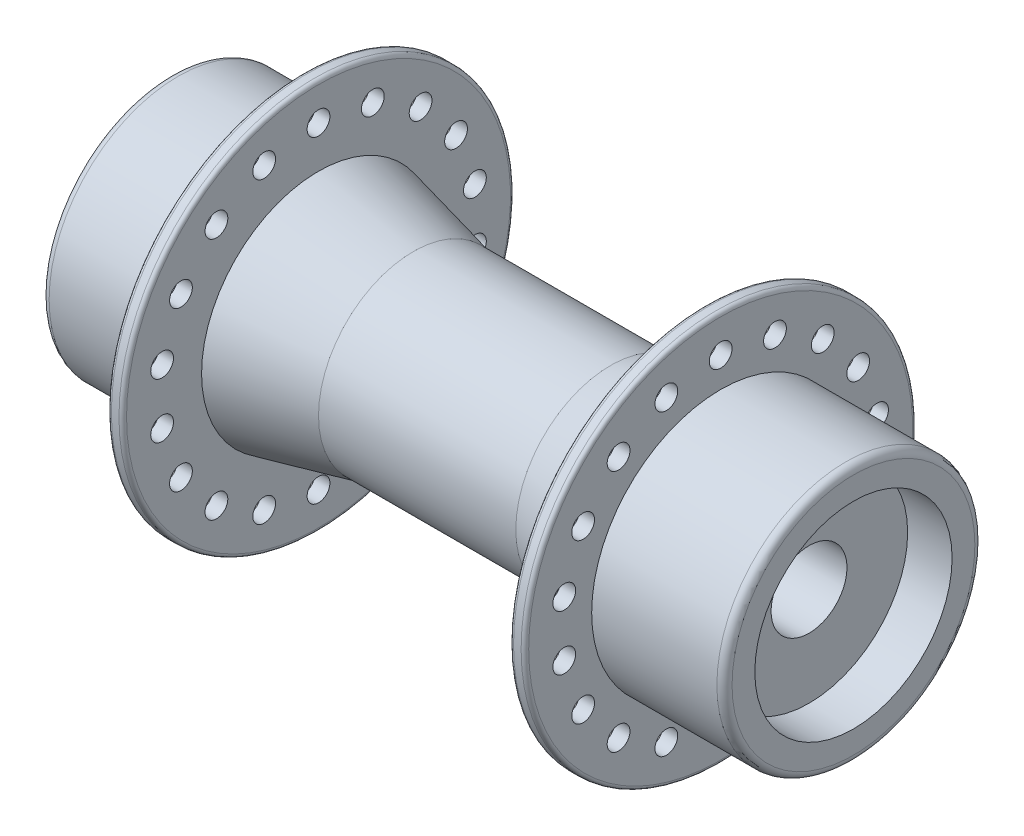
from build123d import *

# Parameters (mm, degrees)
CUT_EXTRUDE1_REACH       = 83.164
SKETCH2_R                = 1.5
CIRPATTERN1_COUNT        = 18
MIRROR1_COPY_1_REACH     = 83.164
MIRROR1_COPY_1_SKETCH_R  = 1.5
MIRROR1_COPY_2_REACH     = 83.164
MIRROR1_COPY_2_SKETCH_R  = 1.5
MIRROR1_COPY_3_REACH     = 83.164
MIRROR1_COPY_3_SKETCH_R  = 1.5
MIRROR1_COPY_4_REACH     = 83.164
MIRROR1_COPY_4_SKETCH_R  = 1.5
MIRROR1_COPY_5_REACH     = 83.164
MIRROR1_COPY_5_SKETCH_R  = 1.5
MIRROR1_COPY_6_REACH     = 83.164
MIRROR1_COPY_6_SKETCH_R  = 1.5
MIRROR1_COPY_7_REACH     = 83.164
MIRROR1_COPY_7_SKETCH_R  = 1.5
MIRROR1_COPY_8_REACH     = 83.164
MIRROR1_COPY_8_SKETCH_R  = 1.5
MIRROR1_COPY_9_REACH     = 83.164
MIRROR1_COPY_9_SKETCH_R  = 1.5
MIRROR1_COPY_10_REACH    = 83.164
MIRROR1_COPY_10_SKETCH_R = 1.5
MIRROR1_COPY_11_REACH    = 83.164
MIRROR1_COPY_11_SKETCH_R = 1.5
MIRROR1_COPY_12_REACH    = 83.164
MIRROR1_COPY_12_SKETCH_R = 1.5
MIRROR1_COPY_13_REACH    = 83.164
MIRROR1_COPY_13_SKETCH_R = 1.5
MIRROR1_COPY_14_REACH    = 83.164
MIRROR1_COPY_14_SKETCH_R = 1.5
MIRROR1_COPY_15_REACH    = 83.164
MIRROR1_COPY_15_SKETCH_R = 1.5
MIRROR1_COPY_16_REACH    = 83.164
MIRROR1_COPY_16_SKETCH_R = 1.5
MIRROR1_COPY_17_REACH    = 83.164
MIRROR1_COPY_17_SKETCH_R = 1.5


with BuildPart() as part:
    # Sketch1 → Revolve1 (revolve)
    with BuildSketch(Plane.XY, mode=Mode.PRIVATE) as revolve1_sk:
        with BuildLine():
            Line((-44, 17), (-27.5, 17))
            Line((-27.5, 17), (-27.5, 25.3))
            ThreePointArc((-27.5, 25.3), (-27.353553391, 25.653553391), (-27, 25.8))
            Line((-27, 25.8), (-26, 25.8))
            ThreePointArc((-26, 25.8), (-25.646446609, 25.653553391), (-25.5, 25.3))
            Line((-25.5, 25.3), (-25.5, 15.41105918))
            Line((-25.5, 15.41105918), (-13, 12.5))
            Line((-13, 12.5), (13, 12.5))
            Line((13, 12.5), (25.5, 15.41105918))
            Line((25.5, 15.41105918), (25.5, 25.3))
            ThreePointArc((25.5, 25.3), (25.646446609, 25.653553391), (26, 25.8))
            Line((26, 25.8), (27, 25.8))
            ThreePointArc((27, 25.8), (27.353553391, 25.653553391), (27.5, 25.3))
            Line((27.5, 25.3), (27.5, 17))
            Line((27.5, 17), (44, 17))
            ThreePointArc((44, 17), (44.707106781, 16.707106781), (45, 16))
            Line((45, 16), (45, 13))
            Line((45, 13), (39.143298455, 13))
            Line((39.143298455, 13), (39.143298455, 12.5))
            Line((39.143298455, 12.5), (39.143298455, 5))
            Line((39.143298455, 5), (-39.143298455, 5))
            Line((-39.143298455, 5), (-39.143298455, 12.5))
            Line((-39.143298455, 12.5), (-39.143298455, 13))
            Line((-39.143298455, 13), (-45, 13))
            Line((-45, 13), (-45, 16))
            ThreePointArc((-45, 16), (-44.707106781, 16.707106781), (-44, 17))
        make_face()
    revolve(revolve1_sk.sketch.rotate(Axis((0, 0, 0), (1, 0, 0)), 90), axis=Axis((0, 0, 0), (1, 0, 0)))

    # Sketch2 → Cut-Extrude1 (cut, up to next)
    with BuildSketch(Plane(origin=(27.5, 0, 0), x_dir=(0, 0, -1), z_dir=(1, 0, 0)), mode=Mode.PRIVATE) as cut_extrude1_sk1:
        with Locations((0, 20.930422405)):
            Circle(SKETCH2_R)
    cut_extrude1_tool1 = extrude(cut_extrude1_sk1.sketch, amount=-CUT_EXTRUDE1_REACH, mode=Mode.PRIVATE) & part.part
    cut_extrude1 = cut_extrude1_tool1.solids().sort_by_distance((27.5, 20.930422, 0))[0]
    add(cut_extrude1, mode=Mode.SUBTRACT)

    # CirPattern1: Cut-Extrude1 ×18 about axis
    cirpattern1_axis = Axis((0, 0, 0), (1, 0, 0))
    for i in range(1, CIRPATTERN1_COUNT):
        add(cut_extrude1.rotate(cirpattern1_axis, i * 360 / CIRPATTERN1_COUNT), mode=Mode.SUBTRACT)

    # Mirror1: Cut-Extrude1 across plane
    add(cut_extrude1.mirror(Plane(origin=(0, 0, 0), x_dir=(0, 0, 1), z_dir=(1, 0, 0))), mode=Mode.SUBTRACT)

    # Mirror1 copy 1 sketch → Mirror1 copy 1 (cut, up to next)
    with BuildSketch(Plane(origin=(-27.5, 0, 0), x_dir=(0, 0.3420201433256687, -0.9396926207859084), z_dir=(-1, 0, 0)), mode=Mode.PRIVATE) as mirror1_copy_1_sk1:
        with Locations((0, -20.930422405)):
            Circle(MIRROR1_COPY_1_SKETCH_R)
    mirror1_copy_1_tool1 = extrude(mirror1_copy_1_sk1.sketch, amount=-MIRROR1_COPY_1_REACH, mode=Mode.PRIVATE) & part.part
    add(mirror1_copy_1_tool1.solids().sort_by_distance((-27.5, 19.668163103, 7.158625932))[0], mode=Mode.SUBTRACT)

    # Mirror1 copy 2 sketch → Mirror1 copy 2 (cut, up to next)
    with BuildSketch(Plane(origin=(-27.5, 0, 0), x_dir=(0, 0.6427876096865393, -0.766044443118978), z_dir=(-1, 0, 0)), mode=Mode.PRIVATE) as mirror1_copy_2_sk1:
        with Locations((0, -20.930422405)):
            Circle(MIRROR1_COPY_2_SKETCH_R)
    mirror1_copy_2_tool1 = extrude(mirror1_copy_2_sk1.sketch, amount=-MIRROR1_COPY_2_REACH, mode=Mode.PRIVATE) & part.part
    add(mirror1_copy_2_tool1.solids().sort_by_distance((-27.5, 16.033633465, 13.453815927))[0], mode=Mode.SUBTRACT)

    # Mirror1 copy 3 sketch → Mirror1 copy 3 (cut, up to next)
    with BuildSketch(Plane(origin=(-27.5, 0, 0), x_dir=(0, 0.8660254037844386, -0.5000000000000001), z_dir=(-1, 0, 0)), mode=Mode.PRIVATE) as mirror1_copy_3_sk1:
        with Locations((0, -20.930422405)):
            Circle(MIRROR1_COPY_3_SKETCH_R)
    mirror1_copy_3_tool1 = extrude(mirror1_copy_3_sk1.sketch, amount=-MIRROR1_COPY_3_REACH, mode=Mode.PRIVATE) & part.part
    add(mirror1_copy_3_tool1.solids().sort_by_distance((-27.5, 10.465211, 18.126277164))[0], mode=Mode.SUBTRACT)

    # Mirror1 copy 4 sketch → Mirror1 copy 4 (cut, up to next)
    with BuildSketch(Plane(origin=(-27.5, 0, 0), x_dir=(0, 0.984807753012208, -0.17364817766693041), z_dir=(-1, 0, 0)), mode=Mode.PRIVATE) as mirror1_copy_4_sk1:
        with Locations((0, -20.930422405)):
            Circle(MIRROR1_COPY_4_SKETCH_R)
    mirror1_copy_4_tool1 = extrude(mirror1_copy_4_sk1.sketch, amount=-MIRROR1_COPY_4_REACH, mode=Mode.PRIVATE) & part.part
    add(mirror1_copy_4_tool1.solids().sort_by_distance((-27.5, 3.634529638, 20.612441859))[0], mode=Mode.SUBTRACT)

    # Mirror1 copy 5 sketch → Mirror1 copy 5 (cut, up to next)
    with BuildSketch(Plane(origin=(-27.5, 0, 0), x_dir=(0, 0.984807753012208, 0.1736481776669303), z_dir=(-1, 0, 0)), mode=Mode.PRIVATE) as mirror1_copy_5_sk1:
        with Locations((0, -20.930422405)):
            Circle(MIRROR1_COPY_5_SKETCH_R)
    mirror1_copy_5_tool1 = extrude(mirror1_copy_5_sk1.sketch, amount=-MIRROR1_COPY_5_REACH, mode=Mode.PRIVATE) & part.part
    add(mirror1_copy_5_tool1.solids().sort_by_distance((-27.5, -3.634529638, 20.612441859))[0], mode=Mode.SUBTRACT)

    # Mirror1 copy 6 sketch → Mirror1 copy 6 (cut, up to next)
    with BuildSketch(Plane(origin=(-27.5, 0, 0), x_dir=(0, 0.8660254037844387, 0.4999999999999998), z_dir=(-1, 0, 0)), mode=Mode.PRIVATE) as mirror1_copy_6_sk1:
        with Locations((0, -20.930422405)):
            Circle(MIRROR1_COPY_6_SKETCH_R)
    mirror1_copy_6_tool1 = extrude(mirror1_copy_6_sk1.sketch, amount=-MIRROR1_COPY_6_REACH, mode=Mode.PRIVATE) & part.part
    add(mirror1_copy_6_tool1.solids().sort_by_distance((-27.5, -10.465211, 18.126277164))[0], mode=Mode.SUBTRACT)

    # Mirror1 copy 7 sketch → Mirror1 copy 7 (cut, up to next)
    with BuildSketch(Plane(origin=(-27.5, 0, 0), x_dir=(0, 0.6427876096865395, 0.7660444431189779), z_dir=(-1, 0, 0)), mode=Mode.PRIVATE) as mirror1_copy_7_sk1:
        with Locations((0, -20.930422405)):
            Circle(MIRROR1_COPY_7_SKETCH_R)
    mirror1_copy_7_tool1 = extrude(mirror1_copy_7_sk1.sketch, amount=-MIRROR1_COPY_7_REACH, mode=Mode.PRIVATE) & part.part
    add(mirror1_copy_7_tool1.solids().sort_by_distance((-27.5, -16.033633465, 13.453815927))[0], mode=Mode.SUBTRACT)

    # Mirror1 copy 8 sketch → Mirror1 copy 8 (cut, up to next)
    with BuildSketch(Plane(origin=(-27.5, 0, 0), x_dir=(0, 0.3420201433256689, 0.9396926207859083), z_dir=(-1, 0, 0)), mode=Mode.PRIVATE) as mirror1_copy_8_sk1:
        with Locations((0, -20.930422405)):
            Circle(MIRROR1_COPY_8_SKETCH_R)
    mirror1_copy_8_tool1 = extrude(mirror1_copy_8_sk1.sketch, amount=-MIRROR1_COPY_8_REACH, mode=Mode.PRIVATE) & part.part
    add(mirror1_copy_8_tool1.solids().sort_by_distance((-27.5, -19.668163103, 7.158625932))[0], mode=Mode.SUBTRACT)

    # Mirror1 copy 9 sketch → Mirror1 copy 9 (cut, up to next)
    with BuildSketch(Plane.ZY.offset(27.5), mode=Mode.PRIVATE) as mirror1_copy_9_sk1:
        with Locations((0, -20.930422405)):
            Circle(MIRROR1_COPY_9_SKETCH_R)
    mirror1_copy_9_tool1 = extrude(mirror1_copy_9_sk1.sketch, amount=-MIRROR1_COPY_9_REACH, mode=Mode.PRIVATE) & part.part
    add(mirror1_copy_9_tool1.solids().sort_by_distance((-27.5, -20.930422, 0))[0], mode=Mode.SUBTRACT)

    # Mirror1 copy 10 sketch → Mirror1 copy 10 (cut, up to next)
    with BuildSketch(Plane(origin=(-27.5, 0, 0), x_dir=(0, -0.34202014332566866, 0.9396926207859084), z_dir=(-1, 0, 0)), mode=Mode.PRIVATE) as mirror1_copy_10_sk1:
        with Locations((0, -20.930422405)):
            Circle(MIRROR1_COPY_10_SKETCH_R)
    mirror1_copy_10_tool1 = extrude(mirror1_copy_10_sk1.sketch, amount=-MIRROR1_COPY_10_REACH, mode=Mode.PRIVATE) & part.part
    add(mirror1_copy_10_tool1.solids().sort_by_distance((-27.5, -19.668163103, -7.158625932))[0], mode=Mode.SUBTRACT)

    # Mirror1 copy 11 sketch → Mirror1 copy 11 (cut, up to next)
    with BuildSketch(Plane(origin=(-27.5, 0, 0), x_dir=(0, -0.6427876096865393, 0.766044443118978), z_dir=(-1, 0, 0)), mode=Mode.PRIVATE) as mirror1_copy_11_sk1:
        with Locations((0, -20.930422405)):
            Circle(MIRROR1_COPY_11_SKETCH_R)
    mirror1_copy_11_tool1 = extrude(mirror1_copy_11_sk1.sketch, amount=-MIRROR1_COPY_11_REACH, mode=Mode.PRIVATE) & part.part
    add(mirror1_copy_11_tool1.solids().sort_by_distance((-27.5, -16.033633465, -13.453815927))[0], mode=Mode.SUBTRACT)

    # Mirror1 copy 12 sketch → Mirror1 copy 12 (cut, up to next)
    with BuildSketch(Plane(origin=(-27.5, 0, 0), x_dir=(0, -0.8660254037844384, 0.5000000000000004), z_dir=(-1, 0, 0)), mode=Mode.PRIVATE) as mirror1_copy_12_sk1:
        with Locations((0, -20.930422405)):
            Circle(MIRROR1_COPY_12_SKETCH_R)
    mirror1_copy_12_tool1 = extrude(mirror1_copy_12_sk1.sketch, amount=-MIRROR1_COPY_12_REACH, mode=Mode.PRIVATE) & part.part
    add(mirror1_copy_12_tool1.solids().sort_by_distance((-27.5, -10.465211, -18.126277164))[0], mode=Mode.SUBTRACT)

    # Mirror1 copy 13 sketch → Mirror1 copy 13 (cut, up to next)
    with BuildSketch(Plane(origin=(-27.5, 0, 0), x_dir=(0, -0.984807753012208, 0.17364817766693033), z_dir=(-1, 0, 0)), mode=Mode.PRIVATE) as mirror1_copy_13_sk1:
        with Locations((0, -20.930422405)):
            Circle(MIRROR1_COPY_13_SKETCH_R)
    mirror1_copy_13_tool1 = extrude(mirror1_copy_13_sk1.sketch, amount=-MIRROR1_COPY_13_REACH, mode=Mode.PRIVATE) & part.part
    add(mirror1_copy_13_tool1.solids().sort_by_distance((-27.5, -3.634529638, -20.612441859))[0], mode=Mode.SUBTRACT)

    # Mirror1 copy 14 sketch → Mirror1 copy 14 (cut, up to next)
    with BuildSketch(Plane(origin=(-27.5, 0, 0), x_dir=(0, -0.9848077530122081, -0.17364817766692997), z_dir=(-1, 0, 0)), mode=Mode.PRIVATE) as mirror1_copy_14_sk1:
        with Locations((0, -20.930422405)):
            Circle(MIRROR1_COPY_14_SKETCH_R)
    mirror1_copy_14_tool1 = extrude(mirror1_copy_14_sk1.sketch, amount=-MIRROR1_COPY_14_REACH, mode=Mode.PRIVATE) & part.part
    add(mirror1_copy_14_tool1.solids().sort_by_distance((-27.5, 3.634529638, -20.612441859))[0], mode=Mode.SUBTRACT)

    # Mirror1 copy 15 sketch → Mirror1 copy 15 (cut, up to next)
    with BuildSketch(Plane(origin=(-27.5, 0, 0), x_dir=(0, -0.8660254037844386, -0.5000000000000001), z_dir=(-1, 0, 0)), mode=Mode.PRIVATE) as mirror1_copy_15_sk1:
        with Locations((0, -20.930422405)):
            Circle(MIRROR1_COPY_15_SKETCH_R)
    mirror1_copy_15_tool1 = extrude(mirror1_copy_15_sk1.sketch, amount=-MIRROR1_COPY_15_REACH, mode=Mode.PRIVATE) & part.part
    add(mirror1_copy_15_tool1.solids().sort_by_distance((-27.5, 10.465211, -18.126277164))[0], mode=Mode.SUBTRACT)

    # Mirror1 copy 16 sketch → Mirror1 copy 16 (cut, up to next)
    with BuildSketch(Plane(origin=(-27.5, 0, 0), x_dir=(0, -0.6427876096865396, -0.7660444431189778), z_dir=(-1, 0, 0)), mode=Mode.PRIVATE) as mirror1_copy_16_sk1:
        with Locations((0, -20.930422405)):
            Circle(MIRROR1_COPY_16_SKETCH_R)
    mirror1_copy_16_tool1 = extrude(mirror1_copy_16_sk1.sketch, amount=-MIRROR1_COPY_16_REACH, mode=Mode.PRIVATE) & part.part
    add(mirror1_copy_16_tool1.solids().sort_by_distance((-27.5, 16.033633465, -13.453815927))[0], mode=Mode.SUBTRACT)

    # Mirror1 copy 17 sketch → Mirror1 copy 17 (cut, up to next)
    with BuildSketch(Plane(origin=(-27.5, 0, 0), x_dir=(0, -0.3420201433256686, -0.9396926207859084), z_dir=(-1, 0, 0)), mode=Mode.PRIVATE) as mirror1_copy_17_sk1:
        with Locations((0, -20.930422405)):
            Circle(MIRROR1_COPY_17_SKETCH_R)
    mirror1_copy_17_tool1 = extrude(mirror1_copy_17_sk1.sketch, amount=-MIRROR1_COPY_17_REACH, mode=Mode.PRIVATE) & part.part
    add(mirror1_copy_17_tool1.solids().sort_by_distance((-27.5, 19.668163103, -7.158625932))[0], mode=Mode.SUBTRACT)


solid = part.part
